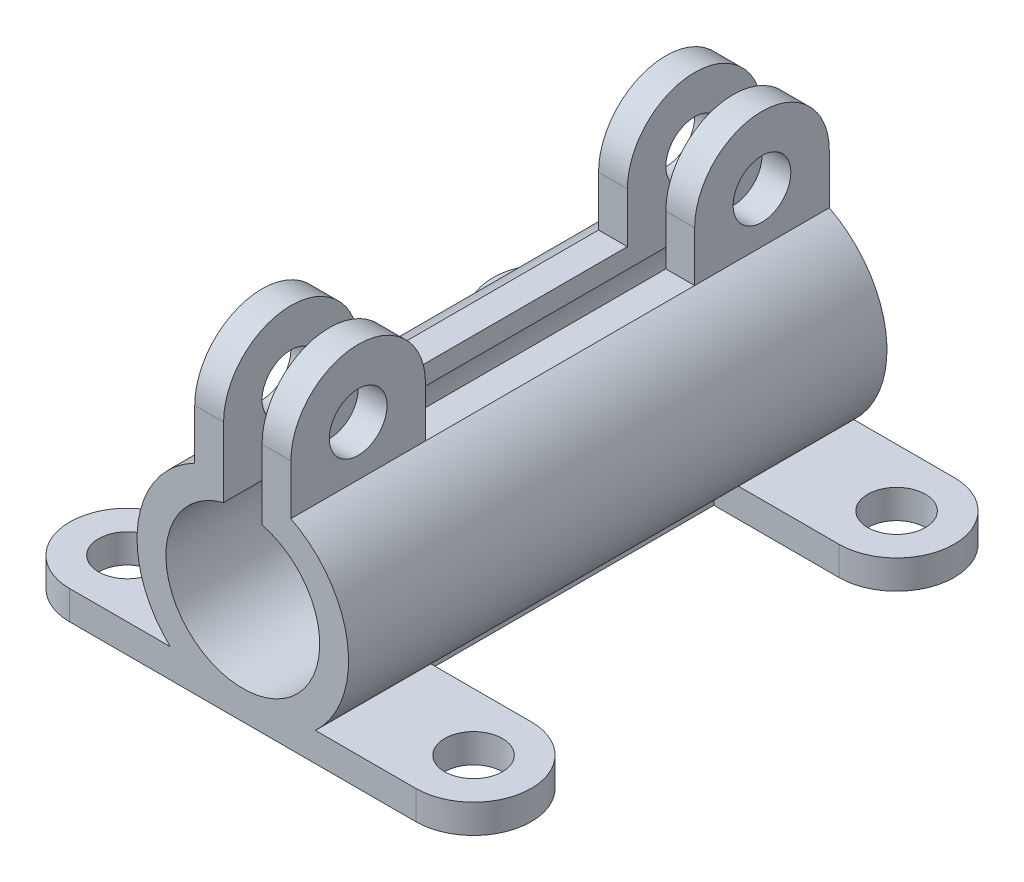
from build123d import *

# Parameters (mm, degrees)
BOSS_EXTRUDE1_DEPTH = 280
SKETCH5_W           = 95
SKETCH5_H           = 160
SKETCH5_W_2         = 95.780958046
CUT_EXTRUDE9_DEPTH  = 280
FILLET1_RADIUS      = 30
FILLET1_LENGTH      = 15
FILLET2_RADIUS      = 30
FILLET2_LENGTH      = 15
FILLET3_RADIUS      = 30
FILLET3_LENGTH      = 15
FILLET4_RADIUS      = 30
FILLET4_LENGTH      = 15
SKETCH7_R           = 15
CUT_EXTRUDE10_DEPTH = 280
SKETCH8_W           = 140
SKETCH8_H           = 61.010205144
CUT_EXTRUDE11_DEPTH = 280
FILLET5_RADIUS      = 35
FILLET5_LENGTH      = 15
FILLET6_RADIUS      = 35
FILLET6_LENGTH      = 15
FILLET7_RADIUS      = 35
FILLET7_LENGTH      = 15
FILLET8_RADIUS      = 35
FILLET8_LENGTH      = 15
SKETCH9_R           = 15
CUT_EXTRUDE12_DEPTH = 280


with BuildPart() as part:
    # Sketch1 → Boss-Extrude1 (new body)
    with BuildSketch(Plane.XY):
        with BuildLine():
            Line((-120, -40), (-37.749172176, -40))
            ThreePointArc((-37.749172176, -40), (-54.444104817, 7.799964787), (-25, 48.989794856))
            Line((-25, 48.989794856), (-25, 110))
            Line((-25, 110), (-10, 110))
            Line((-10, 110), (-10, 38.729833462))
            ThreePointArc((-10, 38.729833462), (0, -40), (10, 38.729833462))
            Line((10, 38.729833462), (10, 110))
            Line((10, 110), (25, 110))
            Line((25, 110), (25, 48.989794856))
            ThreePointArc((25, 48.989794856), (54.444104817, 7.799964787), (37.749172176, -40))
            Line((37.749172176, -40), (120, -40))
            Line((120, -40), (120, -55))
            Line((120, -55), (-120, -55))
            Line((-120, -55), (-120, -40))
        make_face()
    extrude(amount=-BOSS_EXTRUDE1_DEPTH)

    # Sketch5 → Cut-Extrude9 (cut)
    with BuildSketch(Plane(origin=(0, -40, 0), x_dir=(1, 0, 0), z_dir=(0, 1, 0))):
        with Locations((72.5, 140)):
            Rectangle(SKETCH5_W, SKETCH5_H)
        with Locations((-72.109520977, 140)):
            Rectangle(SKETCH5_W_2, SKETCH5_H)
    extrude(amount=-CUT_EXTRUDE9_DEPTH, mode=Mode.SUBTRACT)

    # Fillet1: full round fillet: the end face becomes a half cylinder, R = half its width
    fillet1_face = Plane((-120, -47.5, -250), x_dir=(0, -1, 0), z_dir=(-1, 0, 0))  # on the end face: x along it, z out of the body
    fillet1_slab = fillet1_face.offset(-FILLET1_RADIUS / 2) * Box(FILLET1_LENGTH, 2 * FILLET1_RADIUS, FILLET1_RADIUS, mode=Mode.PRIVATE)  # the body's end, R deep
    fillet1_round = Plane((-90, -47.5, -250), x_dir=(-1, 0, 0), z_dir=(0, -1, 0)) * Cylinder(FILLET1_RADIUS, FILLET1_LENGTH, mode=Mode.PRIVATE)  # its axis R under the face
    add(fillet1_slab - fillet1_round, mode=Mode.SUBTRACT)

    # Fillet2: full round fillet: the end face becomes a half cylinder, R = half its width
    fillet2_face = Plane((-120, -47.5, -30), x_dir=(0, 1, 0), z_dir=(-1, 0, 0))  # on the end face: x along it, z out of the body
    fillet2_slab = fillet2_face.offset(-FILLET2_RADIUS / 2) * Box(FILLET2_LENGTH, 2 * FILLET2_RADIUS, FILLET2_RADIUS, mode=Mode.PRIVATE)  # the body's end, R deep
    fillet2_round = Plane((-90, -47.5, -30), x_dir=(-1, 0, 0), z_dir=(0, 1, 0)) * Cylinder(FILLET2_RADIUS, FILLET2_LENGTH, mode=Mode.PRIVATE)  # its axis R under the face
    add(fillet2_slab - fillet2_round, mode=Mode.SUBTRACT)

    # Fillet3: full round fillet: the end face becomes a half cylinder, R = half its width
    fillet3_face = Plane((120, -47.5, -250), x_dir=(0, 1, 0), z_dir=(1, 0, 0))  # on the end face: x along it, z out of the body
    fillet3_slab = fillet3_face.offset(-FILLET3_RADIUS / 2) * Box(FILLET3_LENGTH, 2 * FILLET3_RADIUS, FILLET3_RADIUS, mode=Mode.PRIVATE)  # the body's end, R deep
    fillet3_round = Plane((90, -47.5, -250), x_dir=(1, 0, 0), z_dir=(0, 1, 0)) * Cylinder(FILLET3_RADIUS, FILLET3_LENGTH, mode=Mode.PRIVATE)  # its axis R under the face
    add(fillet3_slab - fillet3_round, mode=Mode.SUBTRACT)

    # Fillet4: full round fillet: the end face becomes a half cylinder, R = half its width
    fillet4_face = Plane((120, -47.5, -30), x_dir=(0, -1, 0), z_dir=(1, 0, 0))  # on the end face: x along it, z out of the body
    fillet4_slab = fillet4_face.offset(-FILLET4_RADIUS / 2) * Box(FILLET4_LENGTH, 2 * FILLET4_RADIUS, FILLET4_RADIUS, mode=Mode.PRIVATE)  # the body's end, R deep
    fillet4_round = Plane((90, -47.5, -30), x_dir=(1, 0, 0), z_dir=(0, -1, 0)) * Cylinder(FILLET4_RADIUS, FILLET4_LENGTH, mode=Mode.PRIVATE)  # its axis R under the face
    add(fillet4_slab - fillet4_round, mode=Mode.SUBTRACT)

    # Sketch7 → Cut-Extrude10 (cut)
    with BuildSketch(Plane(origin=(0, -40, 0), x_dir=(1, 0, 0), z_dir=(0, 1, 0))):
        with Locations(Location((-90, 250, 0), (0, 0, 180))):
            Circle(SKETCH7_R)
        with Locations(Location((90, 250, 0), (0, 0, 180))):
            Circle(SKETCH7_R)
        with Locations(Location((90, 30, 0), (0, 0, 180))):
            Circle(SKETCH7_R)
        with Locations(Location((-90, 30, 0), (0, 0, 180))):
            Circle(SKETCH7_R)
    extrude(amount=-CUT_EXTRUDE10_DEPTH, mode=Mode.SUBTRACT)

    # Sketch8 → Cut-Extrude11 (cut)
    with BuildSketch(Plane(origin=(25, 0, 0), x_dir=(0, 0, -1), z_dir=(1, 0, 0))):
        with Locations((140, 79.494897428)):
            Rectangle(SKETCH8_W, SKETCH8_H)
    extrude(amount=-CUT_EXTRUDE11_DEPTH, mode=Mode.SUBTRACT)

    # Fillet5: full round fillet: the end face becomes a half cylinder, R = half its width
    fillet5_face = Plane((17.5, 110, -35), x_dir=(1, 0, 0), z_dir=(0, 1, 0))  # on the end face: x along it, z out of the body
    fillet5_slab = fillet5_face.offset(-FILLET5_RADIUS / 2) * Box(FILLET5_LENGTH, 2 * FILLET5_RADIUS, FILLET5_RADIUS, mode=Mode.PRIVATE)  # the body's end, R deep
    fillet5_round = Plane((17.5, 75, -35), x_dir=(0, 1, 0), z_dir=(1, 0, 0)) * Cylinder(FILLET5_RADIUS, FILLET5_LENGTH, mode=Mode.PRIVATE)  # its axis R under the face
    add(fillet5_slab - fillet5_round, mode=Mode.SUBTRACT)

    # Fillet6: full round fillet: the end face becomes a half cylinder, R = half its width
    fillet6_face = Plane((-17.5, 110, -35), x_dir=(1, 0, 0), z_dir=(0, 1, 0))  # on the end face: x along it, z out of the body
    fillet6_slab = fillet6_face.offset(-FILLET6_RADIUS / 2) * Box(FILLET6_LENGTH, 2 * FILLET6_RADIUS, FILLET6_RADIUS, mode=Mode.PRIVATE)  # the body's end, R deep
    fillet6_round = Plane((-17.5, 75, -35), x_dir=(0, 1, 0), z_dir=(1, 0, 0)) * Cylinder(FILLET6_RADIUS, FILLET6_LENGTH, mode=Mode.PRIVATE)  # its axis R under the face
    add(fillet6_slab - fillet6_round, mode=Mode.SUBTRACT)

    # Fillet7: full round fillet: the end face becomes a half cylinder, R = half its width
    fillet7_face = Plane((-17.5, 110, -245), x_dir=(1, 0, 0), z_dir=(0, 1, 0))  # on the end face: x along it, z out of the body
    fillet7_slab = fillet7_face.offset(-FILLET7_RADIUS / 2) * Box(FILLET7_LENGTH, 2 * FILLET7_RADIUS, FILLET7_RADIUS, mode=Mode.PRIVATE)  # the body's end, R deep
    fillet7_round = Plane((-17.5, 75, -245), x_dir=(0, 1, 0), z_dir=(1, 0, 0)) * Cylinder(FILLET7_RADIUS, FILLET7_LENGTH, mode=Mode.PRIVATE)  # its axis R under the face
    add(fillet7_slab - fillet7_round, mode=Mode.SUBTRACT)

    # Fillet8: full round fillet: the end face becomes a half cylinder, R = half its width
    fillet8_face = Plane((17.5, 110, -245), x_dir=(1, 0, 0), z_dir=(0, 1, 0))  # on the end face: x along it, z out of the body
    fillet8_slab = fillet8_face.offset(-FILLET8_RADIUS / 2) * Box(FILLET8_LENGTH, 2 * FILLET8_RADIUS, FILLET8_RADIUS, mode=Mode.PRIVATE)  # the body's end, R deep
    fillet8_round = Plane((17.5, 75, -245), x_dir=(0, 1, 0), z_dir=(1, 0, 0)) * Cylinder(FILLET8_RADIUS, FILLET8_LENGTH, mode=Mode.PRIVATE)  # its axis R under the face
    add(fillet8_slab - fillet8_round, mode=Mode.SUBTRACT)

    # Sketch9 → Cut-Extrude12 (cut)
    with BuildSketch(Plane(origin=(25, 0, 0), x_dir=(0, 0, -1), z_dir=(1, 0, 0))):
        with Locations((35, 75)):
            Circle(SKETCH9_R)
        with Locations((245, 75)):
            Circle(SKETCH9_R)
    extrude(amount=-CUT_EXTRUDE12_DEPTH, mode=Mode.SUBTRACT)


solid = part.part
